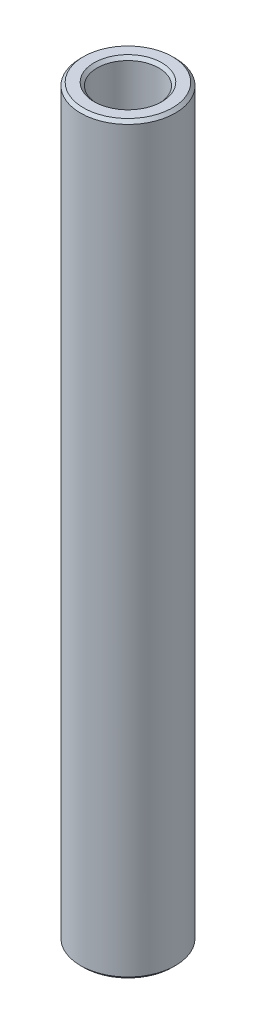
from build123d import *

# Parameters (mm, degrees)
SKETCH1_W     = 0.7
SKETCH1_H     = 31.38678
CHAMFER1_SIZE = 0.127


with BuildPart() as part:
    # Sketch1 → Revolve1 (revolve)
    with BuildSketch(Plane.XY, mode=Mode.PRIVATE) as revolve1_sk:
        with Locations((1.65, 0)):
            Rectangle(SKETCH1_W, SKETCH1_H)
    revolve(revolve1_sk.sketch.rotate(Axis((0, 9.615558323, 0), (0, -1, 0)), 90), axis=Axis((0, 9.615558323, 0), (0, -1, 0)))

    # Chamfer1
    chamfer1_edges = [part.edges().sort_by_distance(p)[0] for p in [
        (0, 15.69339, -1.3),
        (0, 15.69339, -2),
        (0, -15.69339, -2),
        (0, -15.69339, -1.3),
    ]]
    chamfer(chamfer1_edges, length=CHAMFER1_SIZE)


solid = part.part
